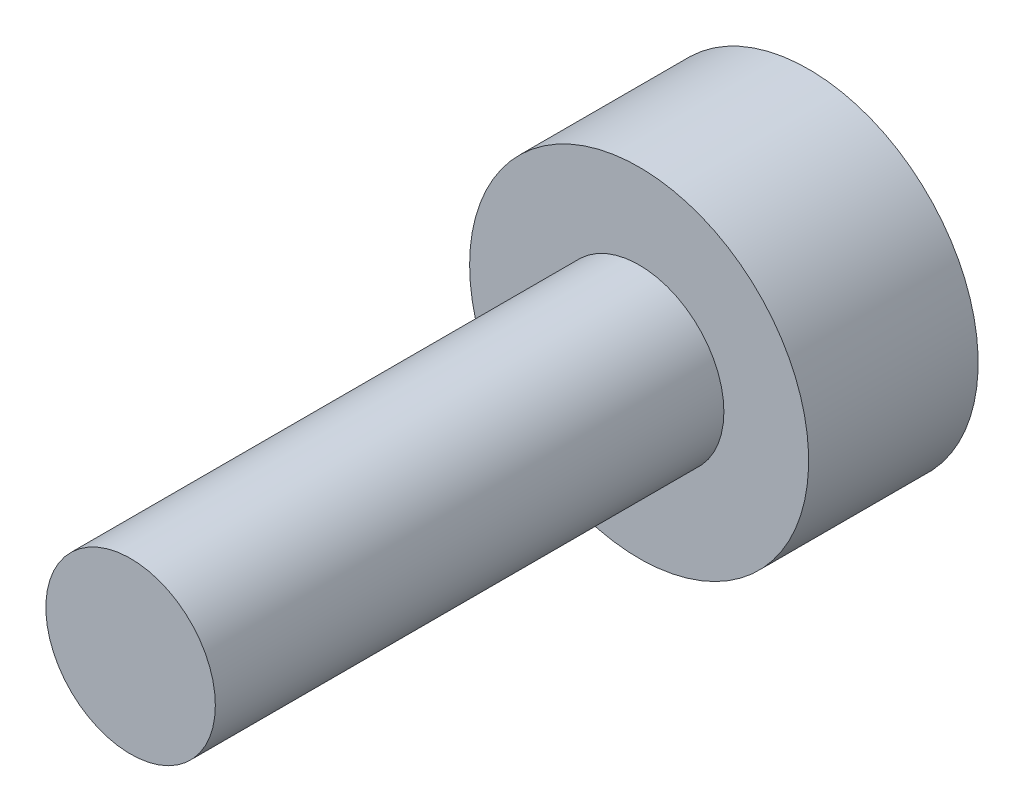
from build123d import *

# Parameters (mm, degrees)
SKETCH_1_R          = 1
EXTRUDE_1_DEPTH     = 6
SKETCH_2_R          = 2
EXTRUDE_2_DEPTH     = 2
CUT_EXTRUDE_1_DEPTH = 1


with BuildPart() as part:
    # 草图1 → 凸台-拉伸1 (new body)
    with BuildSketch(Plane.XY):
        Circle(SKETCH_1_R)
    extrude(amount=EXTRUDE_1_DEPTH)

    # 草图2 → 凸台-拉伸2 (add)
    with BuildSketch(Plane(origin=(0, 0, 0), x_dir=(-1, 0, 0), z_dir=(0, 0, -1))):
        Circle(SKETCH_2_R)
    extrude(amount=EXTRUDE_2_DEPTH)

    # 草图3 → 切除-拉伸1 (cut)
    with BuildSketch(Plane(origin=(0, 0, -2), x_dir=(-1, 0, 0), z_dir=(0, 0, -1))):
        Polygon((1, 0), (0.5, 0.866025404), (-0.5, 0.866025404), (-1, 0), (-0.5, -0.866025404), (0.5, -0.866025404), align=None)
    extrude(amount=-CUT_EXTRUDE_1_DEPTH, mode=Mode.SUBTRACT)


solid = part.part
